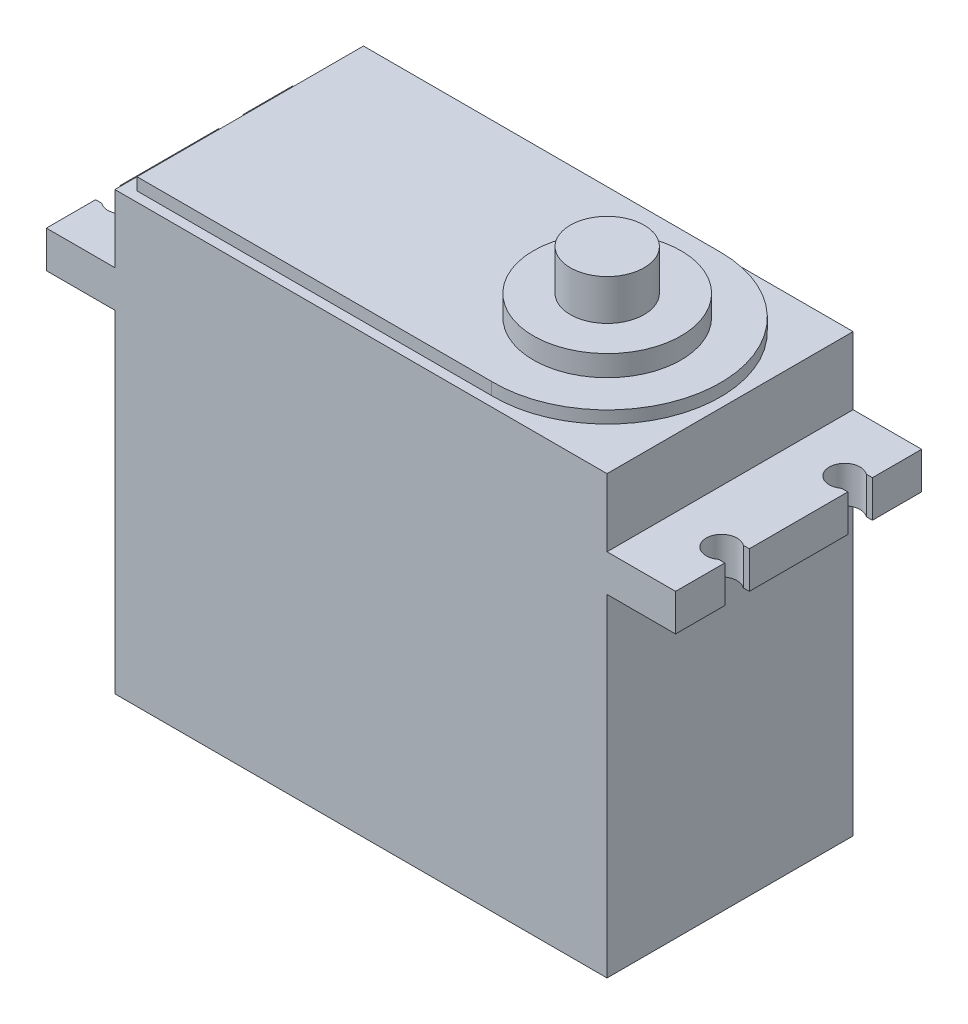
from build123d import *

# Parameters (mm, degrees)
RESSALTO_EXTRUS_O1_DEPTH = 10
CORTE_EXTRUS_O1_DEPTH    = 10
RESSALTO_EXTRUS_O2_DEPTH = 1
ESBO_O4_R                = 3
RESSALTO_EXTRUS_O3_DEPTH = 5
ESBO_O5_R                = 6
RESSALTO_EXTRUS_O4_DEPTH = 1.7


with BuildPart() as part:
    # Esboço1 → Ressalto-extrusão1 (new, symmetric)
    with BuildSketch(Plane.XY):
        Polygon((20, -0.767915455), (25.568877633, -0.767915455), (25.568877633, -3.767915455), (20, -3.767915455), (20, -30.767915455), (-20, -30.767915455), (-20, -3.767915455), (-25.568877633, -3.767915455), (-25.568877633, -0.767915455), (-20, -0.767915455), (-20, 4.732084545), (20, 4.732084545), align=None)
    extrude(amount=RESSALTO_EXTRUS_O1_DEPTH, both=True)

    # Esboço6 → Corte-extrusão1 (cut)
    with BuildSketch(Plane(origin=(0, -0.767915455, 0), x_dir=(1, 0, 0), z_dir=(0, 1, 0))):
        with BuildLine():
            Line((25.071445053, 4), (25.568877633, 4))
            Line((25.568877633, 4), (25.568877633, 6))
            Line((25.568877633, 6), (25.071445053, 6))
            ThreePointArc((25.071445053, 6), (23.061122367, 5), (25.071445053, 4))
        make_face()
        with BuildLine():
            Line((25.568877633, -6), (25.568877633, -4))
            Line((25.568877633, -4), (25.071445053, -4))
            ThreePointArc((25.071445053, -4), (23.061122367, -5), (25.071445053, -6))
            Line((25.071445053, -6), (25.568877633, -6))
        make_face()
        with BuildLine():
            ThreePointArc((-25.071445053, 6), (-23.061122367, 5), (-25.071445053, 4))
            Line((-25.071445053, 4), (-25.568877633, 4))
            Line((-25.568877633, 4), (-25.568877633, 6))
            Line((-25.568877633, 6), (-25.071445053, 6))
        make_face()
        with BuildLine():
            ThreePointArc((-25.071445053, -4), (-23.061122367, -5), (-25.071445053, -6))
            Line((-25.071445053, -6), (-25.568877633, -6))
            Line((-25.568877633, -6), (-25.568877633, -4))
            Line((-25.568877633, -4), (-25.071445053, -4))
        make_face()
    extrude(amount=-CORTE_EXTRUS_O1_DEPTH, mode=Mode.SUBTRACT)

    # Esboço3 → Ressalto-extrusão2 (add)
    with BuildSketch(Plane(origin=(0, 4.732084545, 0), x_dir=(1, 0, 0), z_dir=(0, 1, 0))):
        with BuildLine():
            Line((-19, 9.202511885), (10.015, 9.202511885))
            ThreePointArc((10.015, 9.202511885), (19.216883893, -0.107507336), (9.8, -9.2))
            Line((9.8, -9.2), (-19, -9.2))
            Line((-19, -9.2), (-19, 9.202511885))
        make_face()
    extrude(amount=RESSALTO_EXTRUS_O2_DEPTH)

    # Esboço4 → Ressalto-extrusão3 (add)
    with BuildSketch(Plane(origin=(0, 5.732084545, 0), x_dir=(1, 0, 0), z_dir=(0, 1, 0))):
        with Locations(Location((10.015, 0, 0), (0, 0, 180))):
            Circle(ESBO_O4_R)
    extrude(amount=RESSALTO_EXTRUS_O3_DEPTH)

    # Esboço5 → Ressalto-extrusão4 (add)
    with BuildSketch(Plane(origin=(0, 5.732084545, 0), x_dir=(1, 0, 0), z_dir=(0, 1, 0))):
        with Locations(Location((10.015, 0, 0), (0, 0, 180))):
            Circle(ESBO_O5_R)
    extrude(amount=RESSALTO_EXTRUS_O4_DEPTH)


solid = part.part
